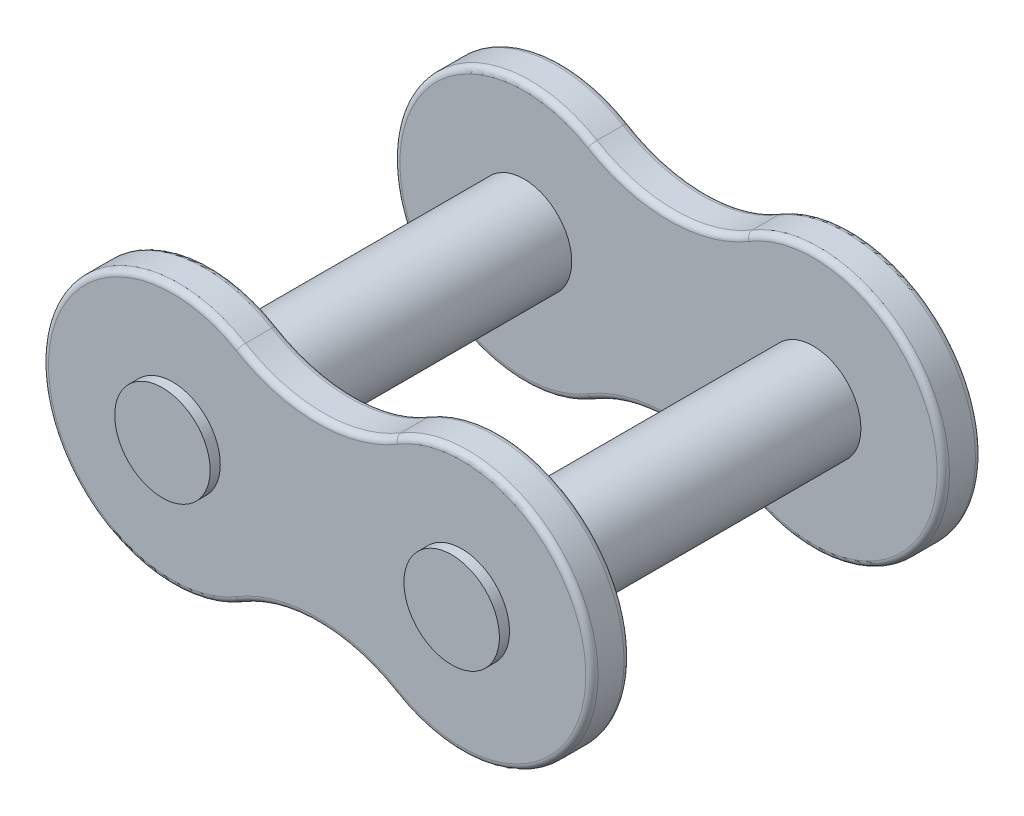
from build123d import *

# Parameters (mm, degrees)
SKETCH1_R           = 1.98
BOSS_EXTRUDE1_DEPTH = 1.5875
BOSS_EXTRUDE3_START = 15
SKETCH2_R           = 1.98
BOSS_EXTRUDE3_DEPTH = 17.0075
FILLET1_R           = 0.254


with BuildPart() as part:
    # Sketch1 → Boss-Extrude1 (new body)
    with BuildSketch(Plane.XY):
        with BuildLine():
            ThreePointArc((-3.221727265, 4.630464406), (-11.4, 0), (-3.221727265, -4.630464406))
            ThreePointArc((-3.221727265, -4.630464406), (0, -3.738099241), (3.221727265, -4.630464406))
            ThreePointArc((3.221727265, -4.630464406), (11.4, 0), (3.221727265, 4.630464406))
            ThreePointArc((3.221727265, 4.630464406), (0, 3.738099241), (-3.221727265, 4.630464406))
        make_face()
        with Locations((-6, 0)):
            Circle(SKETCH1_R, mode=Mode.SUBTRACT)
        with Locations(Location((6, 0, 0), (0, 0, 180))):
            Circle(SKETCH1_R, mode=Mode.SUBTRACT)
    boss_extrude1 = extrude(amount=BOSS_EXTRUDE1_DEPTH)

    # Sketch2 → Boss-Extrude3 (add)
    with BuildSketch(Plane(origin=(0, 0, 0), x_dir=(-1, 0, 0), z_dir=(0, 0, -1)).offset(BOSS_EXTRUDE3_START)):
        with Locations((-6, 0)):
            Circle(SKETCH2_R)
    boss_extrude3 = extrude(amount=-BOSS_EXTRUDE3_DEPTH)

    # Mirror1: Boss-Extrude3 across plane
    add(boss_extrude3.mirror(Plane(origin=(0, 0, 0), x_dir=(0, 0, 1), z_dir=(1, 0, 0))))

    # Mirror2: Boss-Extrude1 across plane
    add(boss_extrude1.mirror(Plane(origin=(0, 0, -6.49625), x_dir=(1, 0, 0), z_dir=(0, 0, -1))))

    # Fillet1
    fillet1_edges = [part.edges().sort_by_distance(p)[0] for p in [
        (0, -3.738099241, 1.5875),
        (11.4, 0, 1.5875),
        (0, 3.738099241, -14.58),
        (11.4, 0, -14.58),
        (0, -3.738099241, -14.58),
        (-11.4, 0, -14.58),
        (0, 3.738099241, -12.9925),
        (-11.4, 0, -12.9925),
        (0, -3.738099241, -12.9925),
        (11.4, 0, -12.9925),
        (0, 3.738099241, 1.5875),
        (11.4, 0, 0),
        (0, -3.738099241, 0),
        (-11.4, 0, 0),
        (0, 3.738099241, 0),
        (-11.4, 0, 1.5875),
    ]]
    fillet(fillet1_edges, radius=FILLET1_R)


solid = part.part
